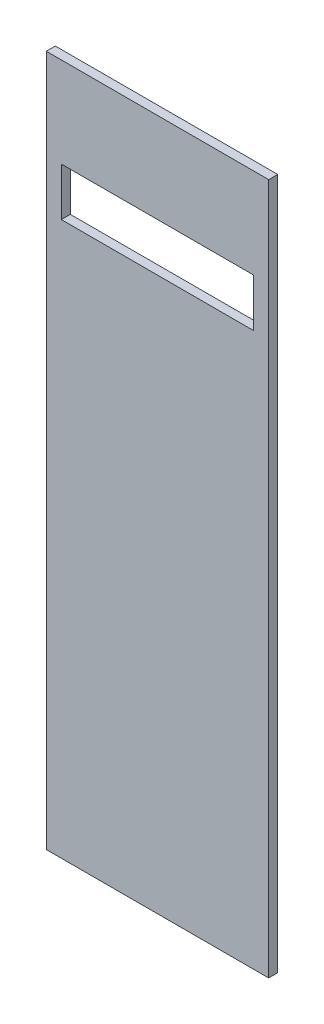
from build123d import *

# Parameters (mm, degrees)
ESBO_O1_W                = 370
ESBO_O1_H                = 1150
RESSALTO_EXTRUS_O1_DEPTH = 15
ESBO_O2_W                = 320
ESBO_O2_H                = 80
CORTE_EXTRUS_O1_DEPTH    = 15


with BuildPart() as part:
    # Esboço1 → Ressalto-extrusão1 (new body)
    with BuildSketch(Plane.XY):
        Rectangle(ESBO_O1_W, ESBO_O1_H)
    extrude(amount=RESSALTO_EXTRUS_O1_DEPTH)

    # Esboço2 → Corte-extrusão1 (cut)
    with BuildSketch(Plane.XY.offset(15)):
        with Locations((0, 385)):
            Rectangle(ESBO_O2_W, ESBO_O2_H)
    extrude(amount=-CORTE_EXTRUS_O1_DEPTH, mode=Mode.SUBTRACT)


solid = part.part
